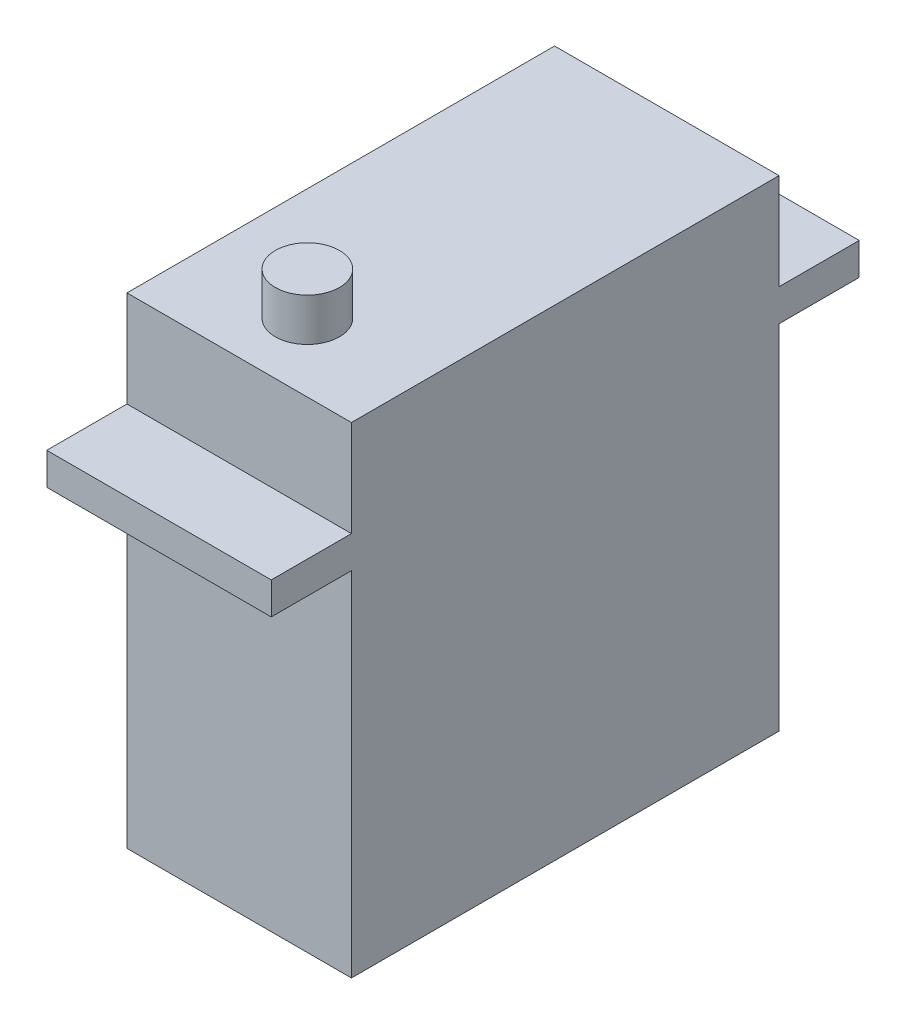
from build123d import *

# Parameters (mm, degrees)
SKETCH1_W           = 21
SKETCH1_H           = 40
BOSS_EXTRUDE1_DEPTH = 45
SKETCH2_W           = 21
SKETCH2_H           = 3
BOSS_EXTRUDE2_DEPTH = 7.5
SKETCH3_W           = 21
SKETCH3_H           = 3
BOSS_EXTRUDE3_DEPTH = 7.5
SKETCH5_R           = 3
BOSS_EXTRUDE4_DEPTH = 4


with BuildPart() as part:
    # Sketch1 → Boss-Extrude1 (new body)
    with BuildSketch(Plane(origin=(0, 0, 0), x_dir=(1, 0, 0), z_dir=(0, 1, 0))):
        Rectangle(SKETCH1_W, SKETCH1_H)
    extrude(amount=BOSS_EXTRUDE1_DEPTH)

    # Sketch2 → Boss-Extrude2 (add)
    with BuildSketch(Plane.XY.offset(20)):
        with Locations((0, 34.5)):
            Rectangle(SKETCH2_W, SKETCH2_H)
    extrude(amount=BOSS_EXTRUDE2_DEPTH)

    # Sketch3 → Boss-Extrude3 (add)
    with BuildSketch(Plane(origin=(0, 0, -20), x_dir=(-1, 0, 0), z_dir=(0, 0, -1))):
        with Locations((0, 34.5)):
            Rectangle(SKETCH3_W, SKETCH3_H)
    extrude(amount=BOSS_EXTRUDE3_DEPTH)

    # Sketch5 → Boss-Extrude4 (add)
    with BuildSketch(Plane(origin=(0, 45, 0), x_dir=(1, 0, 0), z_dir=(0, 1, 0))):
        with Locations(Location((0, -13.620158604, 0), (0, 0, 90))):
            Circle(SKETCH5_R)
    extrude(amount=BOSS_EXTRUDE4_DEPTH)


solid = part.part
